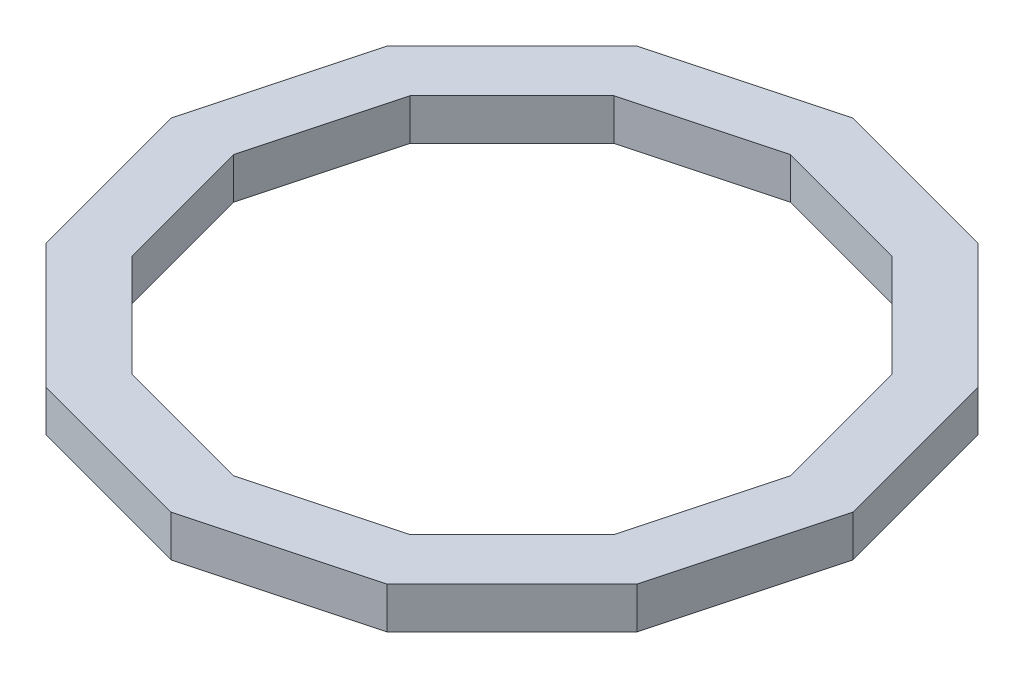
from build123d import *

# Parameters (mm, degrees)
BOSS_EXTRUDE2_DEPTH = 19.05


with BuildPart() as part:
    # Sketch2 → Boss-Extrude2 (new body)
    with BuildSketch(Plane(origin=(0, 0, 0), x_dir=(1, 0, 0), z_dir=(0, 1, 0))):
        Polygon((-157.020902322, 0), (-135.984090336, -78.510451161), (-78.510451161, -135.984090336), (0, -157.020902322), (78.510451161, -135.984090336), (135.984090336, -78.510451161), (157.020902322, 0), (135.984090336, 78.510451161), (78.510451161, 135.984090336), (0, 157.020902322), (-78.510451161, 135.984090336), (-135.984090336, 78.510451161), align=None)
        Polygon((-128.095285841, 0), (-110.933771643, -64.04764292), (-64.04764292, -110.933771643), (0, -128.095285841), (64.04764292, -110.933771643), (110.933771643, -64.04764292), (128.095285841, 0), (110.933771643, 64.04764292), (64.04764292, 110.933771643), (0, 128.095285841), (-64.04764292, 110.933771643), (-110.933771643, 64.04764292), align=None, mode=Mode.SUBTRACT)
    extrude(amount=BOSS_EXTRUDE2_DEPTH)


solid = part.part
